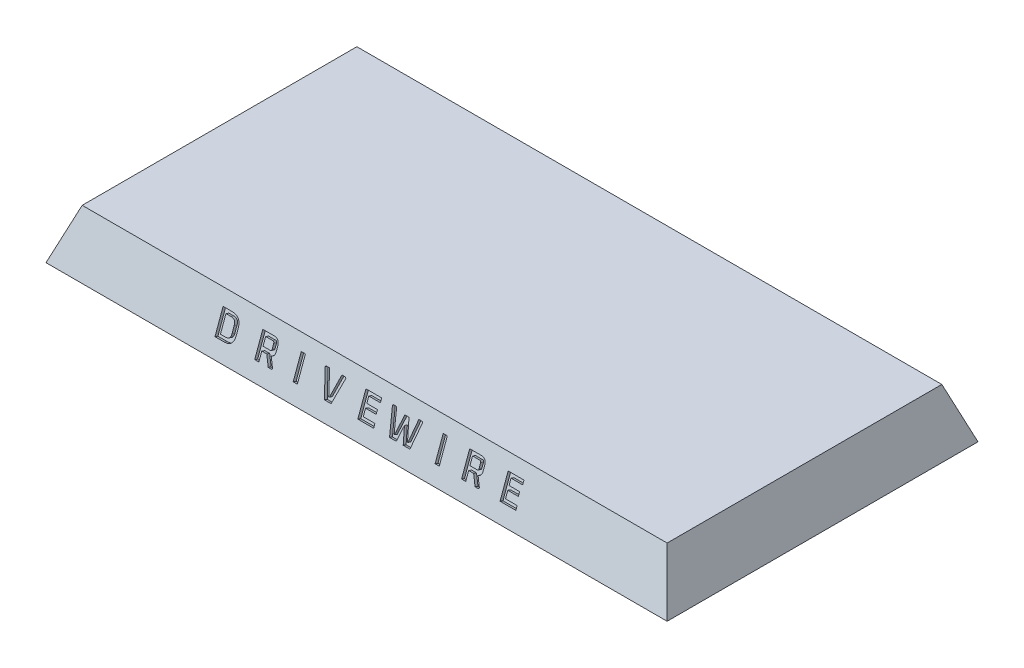
from build123d import *

# Parameters (mm, degrees)
SKETCH1_W           = 200
SKETCH1_H           = 30
BOSS_EXTRUDE1_DEPTH = 16
BOSS_EXTRUDE1_TAPER = 20
SKETCH4_W           = 1.337512245
SKETCH4_H           = 7.615728082
SKETCH4_W_2         = 1.337512244
CUT_EXTRUDE2_DEPTH  = 1
BOSS_EXTRUDE2_DEPTH = 35.05
BOSS_EXTRUDE3_DEPTH = 35.05


with BuildPart() as part:
    # Sketch1 → Boss-Extrude1 (new body)
    with BuildSketch(Plane(origin=(0, 0, 0), x_dir=(1, 0, 0), z_dir=(0, 1, 0))):
        Rectangle(SKETCH1_W, SKETCH1_H)
    extrude(amount=BOSS_EXTRUDE1_DEPTH, taper=BOSS_EXTRUDE1_TAPER)

    # Sketch4 → Cut-Extrude2 (cut)
    # profile 1 of 9: a face of its own
    with BuildSketch(Plane(origin=(0, 4.820907073, 13.245333323), x_dir=(1, 0, 0), z_dir=(0, 0.34202014332566905, 0.9396926207859083))):
        with BuildLine():
            Line((-47.343614569, 0), (-47.343614569, 7.615728082))
            Line((-47.343614569, 7.615728082), (-44.438531627, 7.615728082))
            add(Edge.make_bspline(
                [(-44.438531627, 7.615728082), (-44.318913294, 7.613872468), (-44.087064314, 7.610275845), (-43.750713206, 7.574705752), (-43.437236589, 7.517251731), (-43.14686624, 7.434197605), (-42.878616115, 7.33041204), (-42.633684216, 7.200972743), (-42.412095218, 7.048185753), (-42.213081993, 6.872518817), (-42.039106699, 6.671884082), (-41.887377494, 6.448454399), (-41.760538835, 6.200912204), (-41.657404023, 5.930423028), (-41.576910201, 5.637046352), (-41.51866299, 5.320228155), (-41.483497612, 4.980108574), (-41.47981339, 4.745637054), (-41.477917336, 4.6249682)],
                knots=[0, 0, 0, 0, 1.188713315, 2.304011127, 3.357802465, 4.352913975, 5.301847974, 6.21197883, 7.100084463, 7.971523922, 8.843438996, 9.732912908, 10.649926474, 11.601855752, 12.605664396, 13.669791362, 14.800777136, 16, 16, 16, 16], degree=3))
            Line((-41.477917336, 4.6249682), (-41.477917336, 2.990759882))
            add(Edge.make_bspline(
                [(-41.477917336, 2.990759882), (-41.47981339, 2.870091027), (-41.483497612, 2.635619507), (-41.51866299, 2.295499926), (-41.576910201, 1.97868173), (-41.657404023, 1.685305054), (-41.760538835, 1.414815878), (-41.887377494, 1.167273682), (-42.039106699, 0.943843999), (-42.213081993, 0.743209264), (-42.412095218, 0.567542328), (-42.633684216, 0.414755339), (-42.878616115, 0.285316041), (-43.14686624, 0.181530477), (-43.437236589, 0.098476351), (-43.750713206, 0.04102233), (-44.087064314, 0.005452236), (-44.318913294, 0.001855613), (-44.438531627, 0)],
                knots=[0, 0, 0, 0, 1.199222864, 2.330208638, 3.394335604, 4.398144248, 5.350073526, 6.267087092, 7.156561004, 8.028476078, 8.899915537, 9.78802117, 10.698152026, 11.647086025, 12.642197535, 13.695988873, 14.811286685, 16, 16, 16, 16], degree=3))
            Line((-44.438531627, 0), (-47.343614569, 0))
        make_face()
        with BuildLine():
            Line((-46.006102324, 1.216929883), (-44.360787737, 1.216929883))
            add(Edge.make_bspline(
                [(-44.360787737, 1.216929883), (-44.298349984, 1.218259416), (-44.177450828, 1.22083381), (-44.001575073, 1.237487282), (-43.838270097, 1.269581372), (-43.68643116, 1.312429648), (-43.546021055, 1.365720945), (-43.418023999, 1.432604846), (-43.30258317, 1.512832065), (-43.199292671, 1.605045089), (-43.107531322, 1.709054169), (-43.029767898, 1.826450216), (-42.962493008, 1.955414308), (-42.909486521, 2.097517821), (-42.866227701, 2.250209997), (-42.836269234, 2.41541389), (-42.819286877, 2.592688989), (-42.816739282, 2.715181516), (-42.81542958, 2.77815414)],
                knots=[0, 0, 0, 0, 1.189055845, 2.302386679, 3.359069874, 4.353701447, 5.3037939, 6.213754028, 7.096558538, 7.973888864, 8.844546497, 9.729989503, 10.648878363, 11.608371854, 12.612694507, 13.667504363, 14.800878928, 16, 16, 16, 16], degree=3))
            Line((-42.81542958, 2.77815414), (-42.81542958, 4.837573942))
            add(Edge.make_bspline(
                [(-42.81542958, 4.837573942), (-42.816745784, 4.90054458), (-42.819306026, 5.023033243), (-42.836199572, 5.200335471), (-42.866556326, 5.36594737), (-42.908823629, 5.518963713), (-42.962923076, 5.660678974), (-43.029716582, 5.789297264), (-43.107545606, 5.906666167), (-43.199285143, 6.010695101), (-43.302599184, 6.102854812), (-43.417966428, 6.183278833), (-43.546418333, 6.249484386), (-43.685763012, 6.305820413), (-43.83862979, 6.345447522), (-44.001511359, 6.378451182), (-44.177468396, 6.394836261), (-44.298355967, 6.39744891), (-44.360787737, 6.398798199)],
                knots=[0, 0, 0, 0, 1.199026098, 2.332310896, 3.387037208, 4.400978033, 5.350995236, 6.269811316, 7.155184193, 8.025772867, 8.903033706, 9.785768295, 10.695656352, 11.649349095, 12.641196174, 13.697795677, 14.811038332, 16, 16, 16, 16], degree=3))
            Line((-44.360787737, 6.398798199), (-46.006102324, 6.398798199))
            Line((-46.006102324, 6.398798199), (-46.006102324, 1.216929883))
        make_face(mode=Mode.SUBTRACT)
    # profile 2 of 9: a face of its own
    with BuildSketch(Plane(origin=(0, 4.820907073, 13.245333323), x_dir=(1, 0, 0), z_dir=(0, 0.34202014332566905, 0.9396926207859083))):
        with BuildLine():
            Line((-34.549191391, 0), (-34.549191391, 7.615728082))
            Line((-34.549191391, 7.615728082), (-30.909508012, 7.615728082))
            add(Edge.make_bspline(
                [(-30.909508012, 7.615728082), (-30.837511819, 7.614883637), (-30.697379862, 7.613240028), (-30.494368417, 7.589798548), (-30.304736412, 7.55583966), (-30.128750746, 7.507415272), (-29.967950284, 7.441049167), (-29.819291101, 7.36460654), (-29.686281207, 7.270794325), (-29.566133713, 7.16451183), (-29.461671339, 7.042337713), (-29.367496645, 6.908691719), (-29.292673132, 6.757501465), (-29.22803483, 6.593960511), (-29.181936587, 6.415145091), (-29.147030055, 6.223237302), (-29.123959579, 6.017510493), (-29.122267538, 5.875280662), (-29.121398523, 5.802232832)],
                knots=[0, 0, 0, 0, 1.182087601, 2.300791764, 3.352191054, 4.345104074, 5.292142859, 6.205423244, 7.085151355, 7.958895877, 8.83341756, 9.720281201, 10.637273285, 11.597255171, 12.604621065, 13.664564823, 14.800543674, 16, 16, 16, 16], degree=3))
            Line((-29.121398523, 5.802232832), (-29.121398523, 4.544051089))
            add(Edge.make_bspline(
                [(-29.121398523, 4.544051089), (-29.122361444, 4.486905474), (-29.124236232, 4.375644128), (-29.137375841, 4.213079442), (-29.157146693, 4.058674196), (-29.18767504, 3.91306982), (-29.224898062, 3.775773155), (-29.273386139, 3.648350234), (-29.328436158, 3.528356891), (-29.394045203, 3.417298771), (-29.466733345, 3.313901772), (-29.547973891, 3.21917651), (-29.639331873, 3.135166906), (-29.738092487, 3.058814004), (-29.844701581, 2.989594194), (-29.961333696, 2.93187413), (-30.085397314, 2.879689112), (-30.173015494, 2.854485439), (-30.217746045, 2.84161854)],
                knots=[0, 0, 0, 0, 1.245139748, 2.424261664, 3.552145235, 4.634785591, 5.663774039, 6.648438548, 7.602271101, 8.537187548, 9.454898112, 10.353671205, 11.250669234, 12.154305774, 13.071799223, 14.014989741, 14.986618954, 16, 16, 16, 16], degree=3))
            Line((-30.217746045, 2.84161854), (-28.902446341, 0.282416583))
            Line((-28.902446341, 0.282416583), (-29.065867173, 0))
            Line((-29.065867173, 0), (-30.206639775, 0))
            Line((-30.206639775, 0), (-31.61078964, 2.743248719))
            Line((-31.61078964, 2.743248719), (-33.211679147, 2.743248719))
            Line((-33.211679147, 2.743248719), (-33.211679147, 0))
            Line((-33.211679147, 0), (-34.549191391, 0))
        make_face()
        with BuildLine():
            Line((-33.211679147, 3.960178602), (-30.941240213, 3.960178602))
            add(Edge.make_bspline(
                [(-30.941240213, 3.960178602), (-30.9035407, 3.961489273), (-30.832054393, 3.963974584), (-30.732534033, 3.988005443), (-30.64703466, 4.02616374), (-30.576516154, 4.081220732), (-30.523130746, 4.153998237), (-30.484726951, 4.241615552), (-30.46330382, 4.344719732), (-30.460428048, 4.418081344), (-30.458910768, 4.456787538)],
                knots=[0, 0, 0, 0, 1.139197889, 2.160161876, 3.076811787, 3.954193982, 4.834491076, 5.780300629, 6.828868231, 8, 8, 8, 8], degree=3))
            Line((-30.458910768, 4.456787538), (-30.458910768, 5.913295533))
            add(Edge.make_bspline(
                [(-30.458910768, 5.913295533), (-30.460408936, 5.951464512), (-30.463226498, 6.023247789), (-30.484526287, 6.123956033), (-30.524103965, 6.208673942), (-30.575933814, 6.281114915), (-30.647663714, 6.334049645), (-30.732217775, 6.373102459), (-30.832338812, 6.394392714), (-30.903597321, 6.397275398), (-30.941240213, 6.398798199)],
                knots=[0, 0, 0, 0, 1.168286561, 2.197162201, 3.124224936, 4.014521899, 4.891922844, 5.818985579, 6.84786122, 8, 8, 8, 8], degree=3))
            Line((-30.941240213, 6.398798199), (-33.211679147, 6.398798199))
            Line((-33.211679147, 6.398798199), (-33.211679147, 3.960178602))
        make_face(mode=Mode.SUBTRACT)
    # profile 3 of 9: a face of its own
    with BuildSketch(Plane(origin=(0, 4.820907073, 13.245333323), x_dir=(1, 0, 0), z_dir=(0, 0.34202014332566905, 0.9396926207859083))):
        with Locations((-21.492184257, 3.807864041)):
            Rectangle(SKETCH4_W, SKETCH4_H)
    # profile 4 of 9: a face of its own
    with BuildSketch(Plane(origin=(0, 4.820907073, 13.245333323), x_dir=(1, 0, 0), z_dir=(0, 0.34202014332566905, 0.9396926207859083))):
        Polygon((-14.356405705, 7.350764209), (-14.180291993, 7.615728082), (-13.017306851, 7.615728082), (-11.141933811, 1.216929883), (-10.934087898, 1.216929883), (-9.058714858, 7.615728082), (-7.886210056, 7.615728082), (-7.721202614, 7.350764209), (-9.958322738, 0), (-12.130391851, 0), align=None)
    # profile 5 of 9: a face of its own
    with BuildSketch(Plane(origin=(0, 4.820907073, 13.245333323), x_dir=(1, 0, 0), z_dir=(0, 0.34202014332566905, 0.9396926207859083))):
        Polygon((-1.344616956, 0), (-1.344616956, 7.615728082), (3.743641369, 7.615728082), (3.743641369, 6.398798199), (-0.007104711, 6.409904469), (-0.007104711, 4.556743969), (3.413626485, 4.545637699), (3.413626485, 3.339814086), (-0.007104711, 3.350920356), (-0.007104711, 1.216929883), (3.743641369, 1.205823613), (3.743641369, 0), align=None)
    # profile 6 of 9: a face of its own
    with BuildSketch(Plane(origin=(0, 4.820907073, 13.245333323), x_dir=(1, 0, 0), z_dir=(0, 0.34202014332566905, 0.9396926207859083))):
        Polygon((7.280195097, 7.350764209), (7.467415079, 7.615728082), (8.5637626, 7.615728082), (9.912381115, 1.216929883), (10.032963476, 1.216929883), (11.470432152, 6.843049003), (12.796838126, 6.843049003), (14.223200531, 1.216929883), (14.354889163, 1.216929883), (15.703507677, 7.615728082), (16.799855199, 7.615728082), (16.987075181, 7.350764209), (15.417917874, 0), (13.256955031, 0), (12.128875309, 4.480586688), (11.010315247, 0), (8.860458674, 0), align=None)
    # profile 7 of 9: a face of its own
    with BuildSketch(Plane(origin=(0, 4.820907073, 13.245333323), x_dir=(1, 0, 0), z_dir=(0, 0.34202014332566905, 0.9396926207859083))):
        with Locations((24.202184233, 3.807864041)):
            Rectangle(SKETCH4_W_2, SKETCH4_H)
    # profile 8 of 9: a face of its own
    with BuildSketch(Plane(origin=(0, 4.820907073, 13.245333323), x_dir=(1, 0, 0), z_dir=(0, 0.34202014332566905, 0.9396926207859083))):
        with BuildLine():
            Line((32.063043562, 0), (32.063043562, 7.615728082))
            Line((32.063043562, 7.615728082), (35.702726941, 7.615728082))
            add(Edge.make_bspline(
                [(35.702726941, 7.615728082), (35.774723135, 7.614883637), (35.914855092, 7.613240028), (36.117866537, 7.589798548), (36.307498542, 7.55583966), (36.483484208, 7.507415272), (36.64428467, 7.441049167), (36.792943853, 7.36460654), (36.925953747, 7.270794325), (37.046101241, 7.16451183), (37.150563614, 7.042337713), (37.244738308, 6.908691719), (37.319561822, 6.757501465), (37.384200124, 6.593960511), (37.430298367, 6.415145091), (37.465204899, 6.223237302), (37.488275375, 6.017510493), (37.489967415, 5.875280662), (37.49083643, 5.802232832)],
                knots=[0, 0, 0, 0, 1.182087601, 2.300791764, 3.352191054, 4.345104074, 5.292142859, 6.205423244, 7.085151355, 7.958895877, 8.83341756, 9.720281201, 10.637273285, 11.597255171, 12.604621065, 13.664564823, 14.800543674, 16, 16, 16, 16], degree=3))
            Line((37.49083643, 5.802232832), (37.49083643, 4.544051089))
            add(Edge.make_bspline(
                [(37.49083643, 4.544051089), (37.489873509, 4.486905474), (37.487998722, 4.375644128), (37.474859113, 4.213079442), (37.455088261, 4.058674196), (37.424559913, 3.91306982), (37.387336892, 3.775773155), (37.338848815, 3.648350234), (37.283798796, 3.528356891), (37.21818975, 3.417298771), (37.145501609, 3.313901772), (37.064261063, 3.21917651), (36.972903081, 3.135166906), (36.874142466, 3.058814004), (36.767533373, 2.989594194), (36.650901258, 2.93187413), (36.526837639, 2.879689112), (36.43921946, 2.854485439), (36.394488909, 2.84161854)],
                knots=[0, 0, 0, 0, 1.245139748, 2.424261664, 3.552145235, 4.634785591, 5.663774039, 6.648438548, 7.602271101, 8.537187548, 9.454898112, 10.353671205, 11.250669234, 12.154305774, 13.071799223, 14.014989741, 14.986618954, 16, 16, 16, 16], degree=3))
            Line((36.394488909, 2.84161854), (37.709788613, 0.282416583))
            Line((37.709788613, 0.282416583), (37.546367781, 0))
            Line((37.546367781, 0), (36.405595179, 0))
            Line((36.405595179, 0), (35.001445314, 2.743248719))
            Line((35.001445314, 2.743248719), (33.400555807, 2.743248719))
            Line((33.400555807, 2.743248719), (33.400555807, 0))
            Line((33.400555807, 0), (32.063043562, 0))
        make_face()
        with BuildLine():
            Line((33.400555807, 3.960178602), (35.670994741, 3.960178602))
            add(Edge.make_bspline(
                [(35.670994741, 3.960178602), (35.708694254, 3.961489273), (35.780180561, 3.963974584), (35.879700921, 3.988005443), (35.965200294, 4.02616374), (36.0357188, 4.081220732), (36.089104208, 4.153998237), (36.127508003, 4.241615552), (36.148931134, 4.344719732), (36.151806905, 4.418081344), (36.153324186, 4.456787538)],
                knots=[0, 0, 0, 0, 1.139197889, 2.160161876, 3.076811787, 3.954193982, 4.834491076, 5.780300629, 6.828868231, 8, 8, 8, 8], degree=3))
            Line((36.153324186, 4.456787538), (36.153324186, 5.913295533))
            add(Edge.make_bspline(
                [(36.153324186, 5.913295533), (36.151826018, 5.951464512), (36.149008456, 6.023247789), (36.127708667, 6.123956033), (36.088130989, 6.208673942), (36.03630114, 6.281114915), (35.96457124, 6.334049645), (35.880017179, 6.373102459), (35.779896141, 6.394392714), (35.708637633, 6.397275398), (35.670994741, 6.398798199)],
                knots=[0, 0, 0, 0, 1.168286561, 2.197162201, 3.124224936, 4.014521899, 4.891922844, 5.818985579, 6.84786122, 8, 8, 8, 8], degree=3))
            Line((35.670994741, 6.398798199), (33.400555807, 6.398798199))
            Line((33.400555807, 6.398798199), (33.400555807, 3.960178602))
        make_face(mode=Mode.SUBTRACT)
    # profile 9 of 9: a face of its own
    with BuildSketch(Plane(origin=(0, 4.820907073, 13.245333323), x_dir=(1, 0, 0), z_dir=(0, 0.34202014332566905, 0.9396926207859083))):
        Polygon((44.451294575, 0), (44.451294575, 7.615728082), (49.5395529, 7.615728082), (49.5395529, 6.398798199), (45.788806819, 6.409904469), (45.788806819, 4.556743969), (49.209538016, 4.545637699), (49.209538016, 3.339814086), (45.788806819, 3.350920356), (45.788806819, 1.216929883), (49.5395529, 1.205823613), (49.5395529, 0), align=None)
    extrude(amount=-CUT_EXTRUDE2_DEPTH, mode=Mode.SUBTRACT)

    # Sketch11 → Boss-Extrude2 (add, along a direction that is not the sketch's normal)
    with BuildSketch(Plane(origin=(0, 4.820907073, -13.245333323), x_dir=(-1, 0, 0), z_dir=(0, 0.34202014332566905, -0.9396926207859083))):
        Polygon((-94.176476252, 11.89654221), (94.176476252, 11.89654221), (100, -5.13030215), (-100, -5.13030215), align=None)
    extrude(amount=BOSS_EXTRUDE2_DEPTH, dir=(0, 0, -1))


with BuildPart() as part_1:
    # Body-Move/Copy1: moved
    add(part.part.moved(Location((0, 0, 35.05))))

    # Sketch11<2> → Boss-Extrude3 (add, along a direction that is not the sketch's normal)
    with BuildSketch(Plane(origin=(0, 4.820907073, -13.245333323), x_dir=(-1, 0, 0), z_dir=(0, 0.34202014332566905, -0.9396926207859083))):
        Polygon((-94.176476252, 11.89654221), (94.176476252, 11.89654221), (100, -5.13030215), (-100, -5.13030215), align=None)
    extrude(amount=BOSS_EXTRUDE3_DEPTH, dir=(0, 0, -1))


solid = part_1.part
